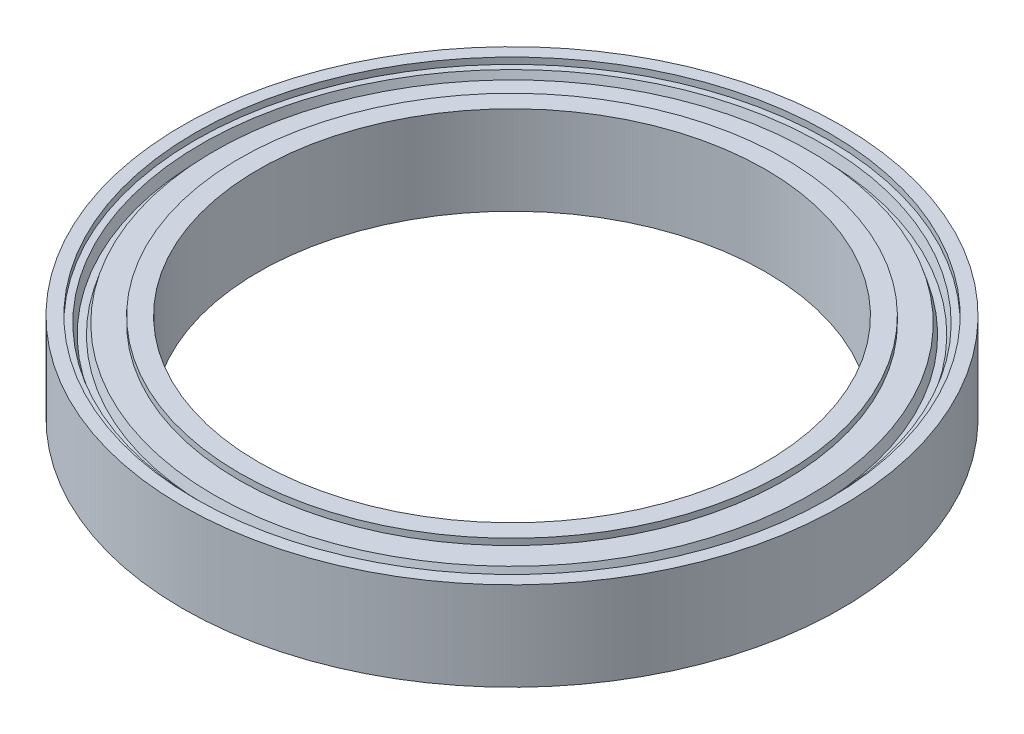
from build123d import *

# Parameters (mm, degrees)
SKETCH_1_R          = 26
SKETCH_1_R_2        = 20
EXTRUDE_1_DEPTH     = 7
SKETCH_2_R          = 25
SKETCH_2_R_2        = 21.5
CUT_EXTRUDE_1_DEPTH = 0.5
SKETCH_3_R          = 24.5
SKETCH_3_R_2        = 23.5
CUT_EXTRUDE_2_DEPTH = 0.8
CUT_EXTRUDE_2_DRAFT = -17


with BuildPart() as part:
    # Эскиз1 → Бобышка-Вытянуть1 (new body)
    with BuildSketch(Plane(origin=(0, 0, 0), x_dir=(1, 0, 0), z_dir=(0, 1, 0))):
        with Locations(Location((0, 0, 0), (0, 0, 270))):
            Circle(SKETCH_1_R)
        with Locations(Location((0, 0, 0), (0, 0, 270))):
            Circle(SKETCH_1_R_2, mode=Mode.SUBTRACT)
    extrude(amount=EXTRUDE_1_DEPTH)

    # Эскиз2 → Вырез-Вытянуть1 (cut)
    with BuildSketch(Plane(origin=(0, 7, 0), x_dir=(1, 0, 0), z_dir=(0, 1, 0))):
        with Locations(Location((0, 0, 0), (0, 0, 270))):
            Circle(SKETCH_2_R)
        with Locations(Location((0, 0, 0), (0, 0, 270))):
            Circle(SKETCH_2_R_2, mode=Mode.SUBTRACT)
    extrude(amount=-CUT_EXTRUDE_1_DEPTH, mode=Mode.SUBTRACT)


with BuildPart() as cut_extrude_2_tool:
    # Эскиз3 → Вырез-Вытянуть2 (with draft: the straight prism first)
    with BuildSketch(Plane(origin=(0, 6.5, 0), x_dir=(1, 0, 0), z_dir=(0, 1, 0))):
        Circle(SKETCH_3_R)
        Circle(SKETCH_3_R_2, mode=Mode.SUBTRACT)
    extrude(amount=-CUT_EXTRUDE_2_DEPTH)
    # Вырез-Вытянуть2: the draft: its side faces are tilted about the plane it starts from
    cut_extrude_2_sides = [cut_extrude_2_tool.faces().sort_by_distance(p)[0] for p in [
        (-24.5, 6.1, 0),
        (-23.5, 6.1, 0),
    ]]
    draft(cut_extrude_2_sides, Plane(origin=(0, 6.5, 0), x_dir=(1, 0, 0), z_dir=(0, 1, 0)), CUT_EXTRUDE_2_DRAFT)


with BuildPart() as part_1:
    add(part.part)

    # Вырез-Вытянуть2: cut by cut_extrude_2_tool
    add(cut_extrude_2_tool.part, mode=Mode.SUBTRACT)


solid = part_1.part
